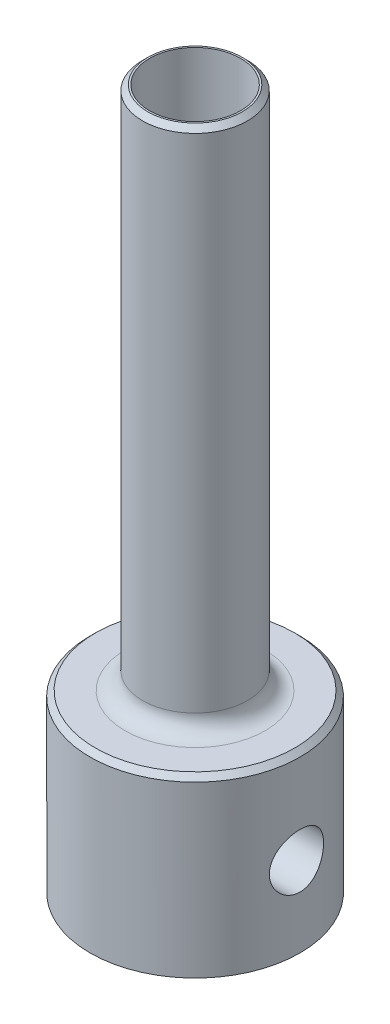
from build123d import *

# Parameters (mm, degrees)
SKETCH6_R               = 6
BOSS_EXTRUDE4_DEPTH     = 10
SKETCH7_R               = 3
BOSS_EXTRUDE5_DEPTH     = 30
CHAMFER1_SIZE           = 0.3
CHAMFER2_SIZE           = 0.3
CUT_EXTRUDE4_DEPTH      = 43.190046219
CUT_EXTRUDE4_DEPTH_BACK = 43.190046219
SKETCH10_R              = 1.55
CUT_EXTRUDE5_DEPTH      = 41.890096728
CUT_EXTRUDE5_DEPTH_BACK = 41.890096728
SKETCH11_R              = 2.6
FILLET1_R               = 1


with BuildPart() as part:
    # Sketch6 → Boss-Extrude4 (new body)
    with BuildSketch(Plane(origin=(0, 0, 0), x_dir=(1, 0, 0), z_dir=(0, 1, 0))):
        with Locations(Location((0, 0, 0), (0, 0, 270))):
            Circle(SKETCH6_R)
    extrude(amount=BOSS_EXTRUDE4_DEPTH)

    # Sketch7 → Boss-Extrude5 (add)
    with BuildSketch(Plane(origin=(0, 10, 0), x_dir=(1, 0, 0), z_dir=(0, 1, 0))):
        with Locations(Location((0, 0, 0), (0, 0, 270))):
            Circle(SKETCH7_R)
    extrude(amount=BOSS_EXTRUDE5_DEPTH)

    # Chamfer1
    chamfer1_edges = [part.edges().sort_by_distance(p)[0] for p in [
        (0, 40, -3),
    ]]
    chamfer(chamfer1_edges, length=CHAMFER1_SIZE)

    # Chamfer2
    chamfer2_edges = [part.edges().sort_by_distance(p)[0] for p in [
        (0, 10, -6),
    ]]
    chamfer(chamfer2_edges, length=CHAMFER2_SIZE)

    # Sketch10 → Cut-Extrude4 (cut, two sides: drawn at the far end of the back side and taken through both)
    with BuildSketch(Plane.ZY.offset(6).offset(-CUT_EXTRUDE4_DEPTH_BACK)):
        with Locations((0, 4.567060469)):
            Circle(SKETCH10_R)
    extrude(amount=CUT_EXTRUDE4_DEPTH + CUT_EXTRUDE4_DEPTH_BACK, mode=Mode.SUBTRACT)

    # Sketch11 → Cut-Extrude5 (cut, two sides: drawn at the far end of the back side and taken through both)
    with BuildSketch(Plane(origin=(0, 40, 0), x_dir=(1, 0, 0), z_dir=(0, 1, 0)).offset(-CUT_EXTRUDE5_DEPTH_BACK)):
        with Locations(Location((0, 0, 0), (0, 0, 270))):
            Circle(SKETCH11_R)
    extrude(amount=CUT_EXTRUDE5_DEPTH + CUT_EXTRUDE5_DEPTH_BACK, mode=Mode.SUBTRACT)

    # Fillet1
    fillet1_edges = [part.edges().sort_by_distance(p)[0] for p in [
        (0, 10, -3),
    ]]
    fillet(fillet1_edges, radius=FILLET1_R)


solid = part.part
